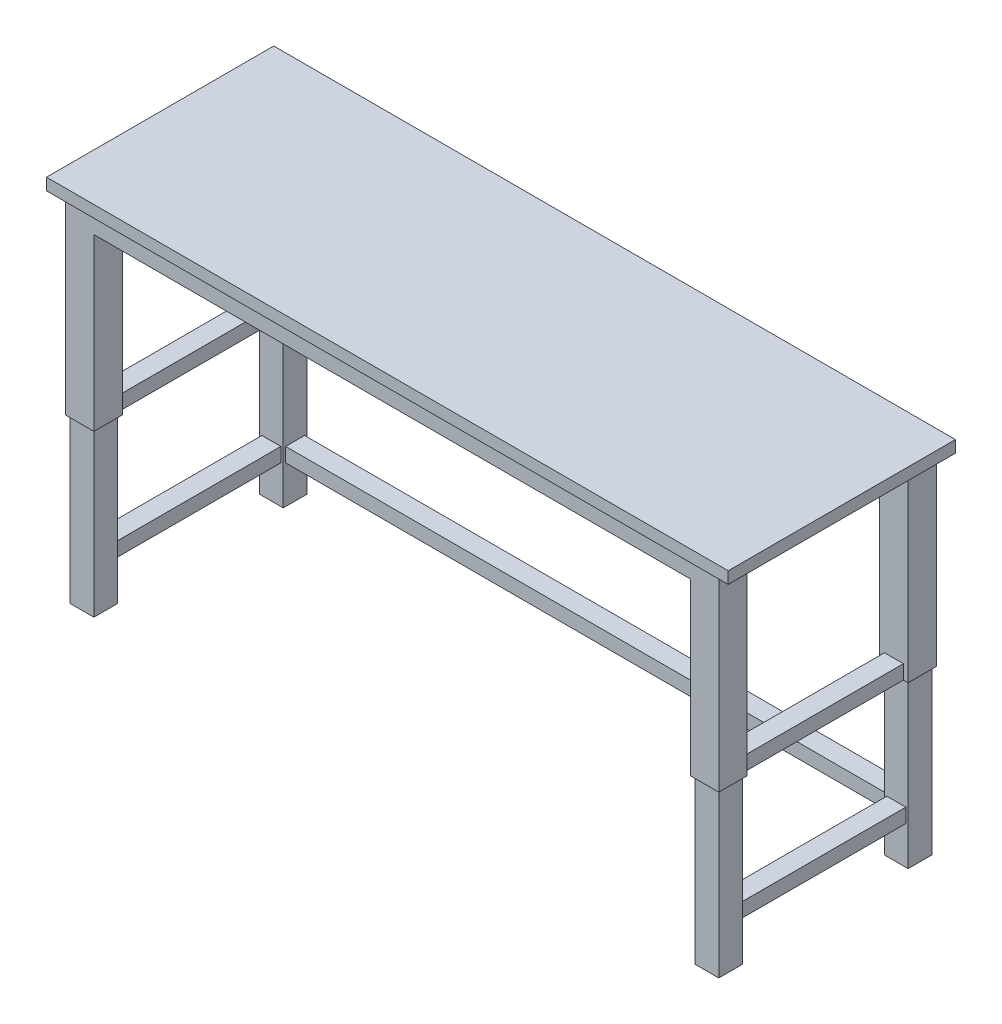
from build123d import *

# Parameters (mm, degrees)
SKETCH1_W                  = 1828.8
SKETCH1_H                  = 609.6
BOSS_EXTRUDE1_DEPTH        = 31.75
BOSS_EXTRUDE2_DEPTH        = 876.3
BOSS_EXTRUDE2_DEPTH_BACK   = 876.3
SKETCH2_W                  = 76.2
SKETCH2_H                  = 50.8
BOSS_EXTRUDE2_2_DEPTH      = 876.3
BOSS_EXTRUDE2_2_DEPTH_BACK = 876.3
SKETCH3_W                  = 76.2
SKETCH3_H                  = 76.2
BOSS_EXTRUDE3_DEPTH        = 508
SKETCH4_W                  = 50.8
SKETCH4_H                  = 38.1
BOSS_EXTRUDE4_DEPTH        = 431.8
SKETCH6_W                  = 63.5
SKETCH6_H                  = 63.5
BOSS_EXTRUDE5_DEPTH        = 438.15
BOSS_EXTRUDE5_2_DEPTH      = 438.15
BOSS_EXTRUDE5_3_DEPTH      = 438.15
BOSS_EXTRUDE5_4_DEPTH      = 438.15
SKETCH7_W                  = 50.8
SKETCH7_H                  = 38.1
BOSS_EXTRUDE6_DEPTH        = 444.5
SKETCH8_W                  = 50.8
SKETCH8_H                  = 38.1
BOSS_EXTRUDE7_DEPTH        = 1612.9


with BuildPart() as part:
    # Sketch1 → Boss-Extrude1 (new body)
    with BuildSketch(Plane(origin=(0, 0, 0), x_dir=(1, 0, 0), z_dir=(0, 1, 0))):
        Rectangle(SKETCH1_W, SKETCH1_H)
    extrude(amount=-BOSS_EXTRUDE1_DEPTH)


with BuildPart() as body_2:
    # Sketch2 → Boss-Extrude2 (new, two sides: drawn at the far end of the back side and taken through both)
    with BuildSketch(Plane(origin=(0, 0, 0), x_dir=(0, 0, -1), z_dir=(1, 0, 0)).offset(-BOSS_EXTRUDE2_DEPTH_BACK)):
        with Locations((-254, -57.15)):
            Rectangle(SKETCH2_W, SKETCH2_H)
    extrude(amount=BOSS_EXTRUDE2_DEPTH + BOSS_EXTRUDE2_DEPTH_BACK)



with BuildPart() as body_3:
    # Sketch2 → Boss-Extrude2 2 (new, two sides: drawn at the far end of the back side and taken through both)
    with BuildSketch(Plane(origin=(0, 0, 0), x_dir=(0, 0, -1), z_dir=(1, 0, 0)).offset(-BOSS_EXTRUDE2_2_DEPTH_BACK)):
        with Locations((254, -57.15)):
            Rectangle(SKETCH2_W, SKETCH2_H)
    extrude(amount=BOSS_EXTRUDE2_2_DEPTH + BOSS_EXTRUDE2_2_DEPTH_BACK)


with BuildPart() as body_2_1:
    add(body_2.part)

    add(body_3.part)  # Boss-Extrude3 merges body 3
    # Sketch3 → Boss-Extrude3 (add)
    with BuildSketch(Plane(origin=(0, -31.75, 0), x_dir=(1, 0, 0), z_dir=(0, 1, 0))):
        with Locations((838.2, -254)):
            Rectangle(SKETCH3_W, SKETCH3_H)
        with Locations((-838.2, -254)):
            Rectangle(SKETCH3_W, SKETCH3_H)
        with Locations((-838.2, 254)):
            Rectangle(SKETCH3_W, SKETCH3_H)
        with Locations((838.2, 254)):
            Rectangle(SKETCH3_W, SKETCH3_H)
    extrude(amount=-BOSS_EXTRUDE3_DEPTH)

    # Sketch4 → Boss-Extrude4 (add)
    with BuildSketch(Plane(origin=(0, 0, 215.9), x_dir=(-1, 0, 0), z_dir=(0, 0, -1))):
        with Locations((-838.2, -520.7)):
            Rectangle(SKETCH4_W, SKETCH4_H)
        with Locations((838.2, -520.7)):
            Rectangle(SKETCH4_W, SKETCH4_H)
    extrude(amount=BOSS_EXTRUDE4_DEPTH)


with BuildPart() as body_3_2:
    # Sketch6 → Boss-Extrude5 (new body)
    with BuildSketch(Plane(origin=(0, -977.9, 0), x_dir=(1, 0, 0), z_dir=(0, 1, 0))):
        with Locations((-838.2, 254)):
            Rectangle(SKETCH6_W, SKETCH6_H)
    extrude(amount=BOSS_EXTRUDE5_DEPTH)



with BuildPart() as body_4:
    # Sketch6 → Boss-Extrude5 2 (new body)
    with BuildSketch(Plane(origin=(0, -977.9, 0), x_dir=(1, 0, 0), z_dir=(0, 1, 0))):
        with Locations((-838.2, -254)):
            Rectangle(SKETCH6_W, SKETCH6_H)
    extrude(amount=BOSS_EXTRUDE5_2_DEPTH)


with BuildPart() as body_5:
    # Sketch6 → Boss-Extrude5 3 (new body)
    with BuildSketch(Plane(origin=(0, -977.9, 0), x_dir=(1, 0, 0), z_dir=(0, 1, 0))):
        with Locations((838.2, -254)):
            Rectangle(SKETCH6_W, SKETCH6_H)
    extrude(amount=BOSS_EXTRUDE5_3_DEPTH)


with BuildPart() as body_6:
    # Sketch6 → Boss-Extrude5 4 (new body)
    with BuildSketch(Plane(origin=(0, -977.9, 0), x_dir=(1, 0, 0), z_dir=(0, 1, 0))):
        with Locations((838.2, 254)):
            Rectangle(SKETCH6_W, SKETCH6_H)
    extrude(amount=BOSS_EXTRUDE5_4_DEPTH)


with BuildPart() as body_3_2_1:
    add(body_3_2.part)

    add(body_4.part)  # Boss-Extrude6 merges body 4

    add(body_5.part)  # Boss-Extrude6 merges body 5

    add(body_6.part)  # Boss-Extrude6 merges body 6
    # Sketch7 → Boss-Extrude6 (add)
    with BuildSketch(Plane(origin=(0, 0, 222.25), x_dir=(-1, 0, 0), z_dir=(0, 0, -1))):
        with Locations((-838.2, -857.25)):
            Rectangle(SKETCH7_W, SKETCH7_H)
        with Locations((838.2, -857.25)):
            Rectangle(SKETCH7_W, SKETCH7_H)
    extrude(amount=BOSS_EXTRUDE6_DEPTH)

    # Sketch8 → Boss-Extrude7 (add)
    with BuildSketch(Plane.ZY.offset(-806.45)):
        with Locations((-254, -857.25)):
            Rectangle(SKETCH8_W, SKETCH8_H)
    extrude(amount=BOSS_EXTRUDE7_DEPTH)


solid = Compound([part.part, body_2_1.part, body_3_2_1.part])
